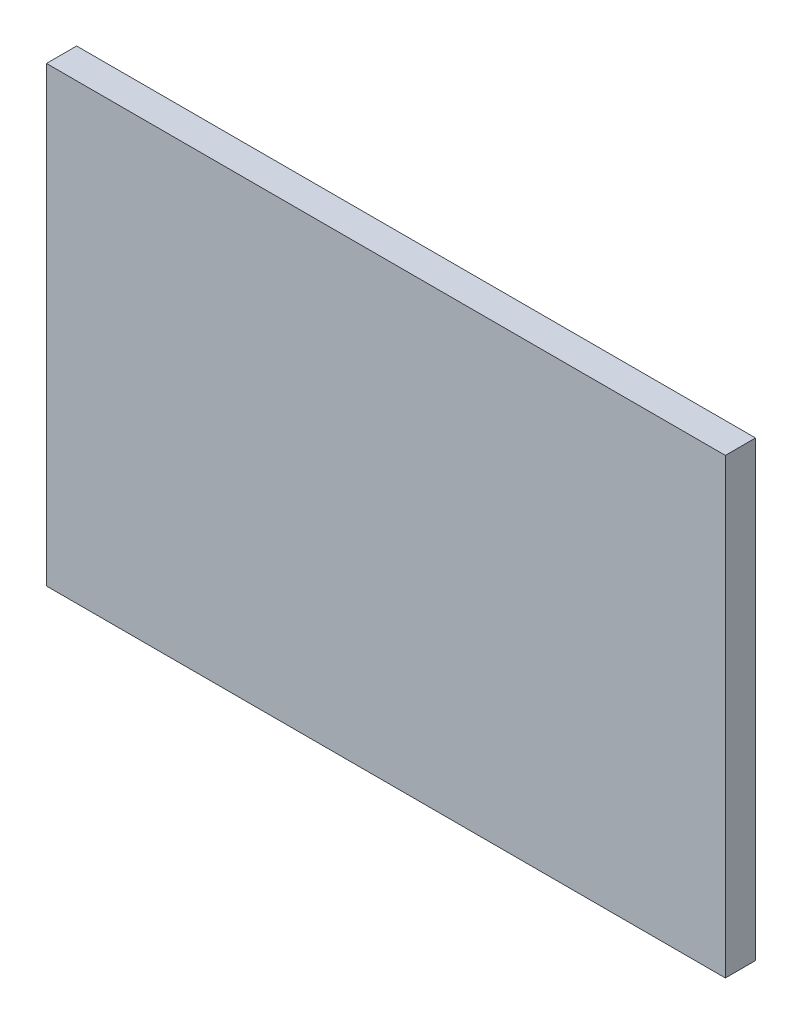
from build123d import *

# Parameters (mm, degrees)
SKETCH1_W           = 90
SKETCH1_H           = 60
BOSS_EXTRUDE1_DEPTH = 4


with BuildPart() as part:
    # Sketch1 → Boss-Extrude1 (new body)
    with BuildSketch(Plane.XY):
        Rectangle(SKETCH1_W, SKETCH1_H)
    extrude(amount=BOSS_EXTRUDE1_DEPTH)


solid = part.part
